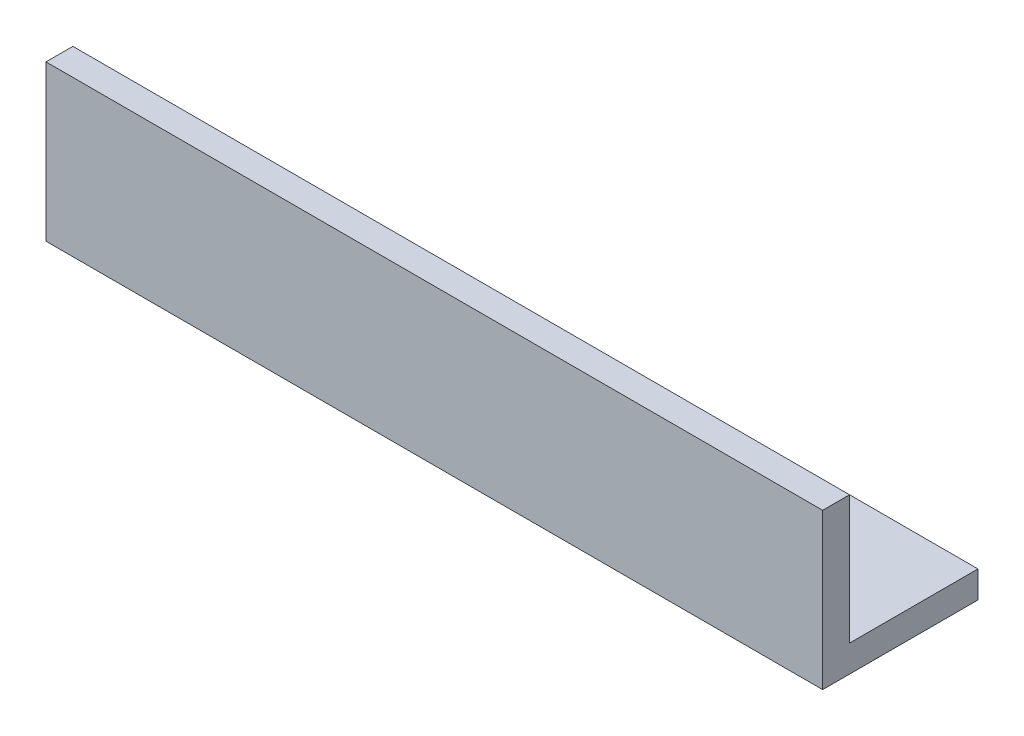
from build123d import *

# Parameters (mm, degrees)
BOSS_EXTRUDE1_DEPTH = 100


with BuildPart() as part:
    # Sketch1 → Boss-Extrude1 (new body)
    with BuildSketch(Plane(origin=(0, 0, 0), x_dir=(0, 0, -1), z_dir=(1, 0, 0))):
        Polygon((0, 0), (20, 0), (20, 3.461178467), (3.461178467, 3.461178467), (3.461178467, 20), (0, 20), align=None)
    extrude(amount=BOSS_EXTRUDE1_DEPTH)


solid = part.part
